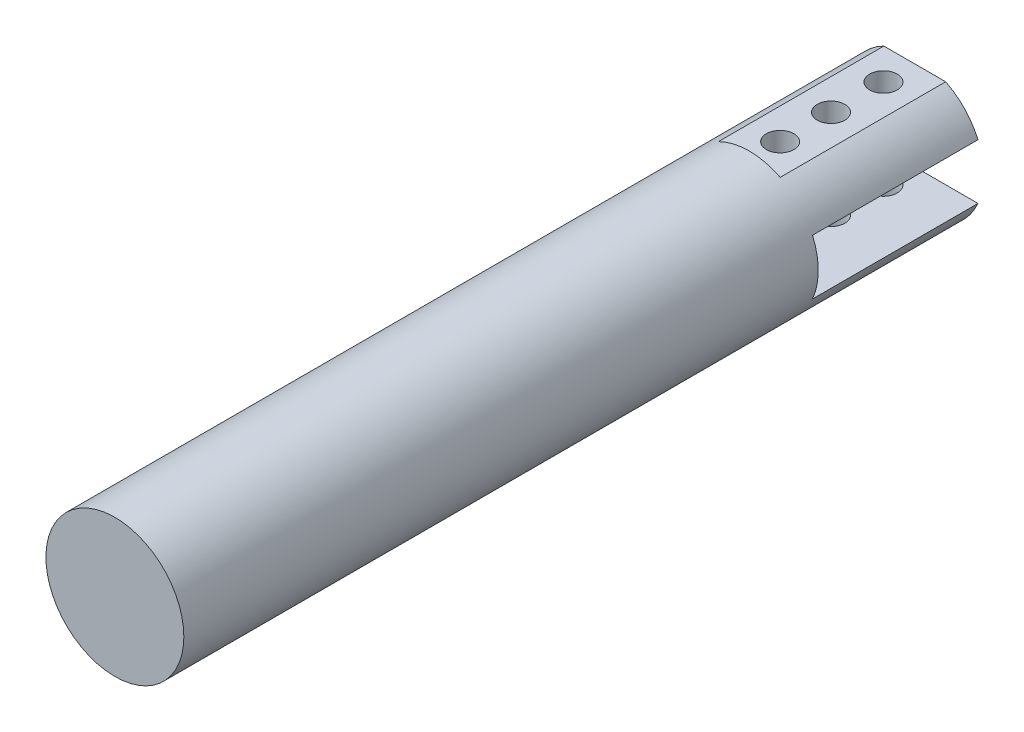
from build123d import *

# Parameters (mm, degrees)
SKETCH_1_R          = 12.5
EXTRUDE_1_DEPTH     = 145
SKETCH_2_W          = 70.200911856
SKETCH_2_H          = 10
CUT_EXTRUDE_2_DEPTH = 30
SKETCH_4_R          = 2.5
CUT_EXTRUDE_1_DEPTH = 35
SKETCH_5_W          = 33.79642712
SKETCH_5_H          = 6.499312907
CUT_EXTRUDE_4_DEPTH = 30


with BuildPart() as part:
    # Эскиз1 → Вытянуть1 (new body)
    with BuildSketch(Plane.XY):
        Circle(SKETCH_1_R)
    extrude(amount=EXTRUDE_1_DEPTH)

    # Эскиз2 → Вытянуть2 (cut)
    with BuildSketch(Plane(origin=(0, 0, 0), x_dir=(-1, 0, 0), z_dir=(0, 0, -1))):
        Rectangle(SKETCH_2_W, SKETCH_2_H)
    extrude(amount=-CUT_EXTRUDE_2_DEPTH, mode=Mode.SUBTRACT)

    # Эскиз4 → Вырез-Вытянуть1 (cut, symmetric)
    with BuildSketch(Plane(origin=(0, 0, 0), x_dir=(1, 0, 0), z_dir=(0, 1, 0))):
        with Locations(Location((0, -5.680597097, 0), (0, 0, 270))):
            Circle(SKETCH_4_R)
        with Locations(Location((0, -15.185844734, 0), (0, 0, 270))):
            Circle(SKETCH_4_R)
        with Locations(Location((0, -24.408758256, 0), (0, 0, 270))):
            Circle(SKETCH_4_R)
    extrude(amount=CUT_EXTRUDE_1_DEPTH, both=True, mode=Mode.SUBTRACT)

    # Эскиз5 → Вытянуть4 (cut)
    with BuildSketch(Plane(origin=(0, 0, 0), x_dir=(-1, 0, 0), z_dir=(0, 0, -1))):
        with Locations((0.724923363, -14.423475184)):
            Rectangle(SKETCH_5_W, SKETCH_5_H)
        with Locations((0.724923363, 14.423475184)):
            Rectangle(SKETCH_5_W, SKETCH_5_H)
    extrude(amount=-CUT_EXTRUDE_4_DEPTH, mode=Mode.SUBTRACT)


solid = part.part
